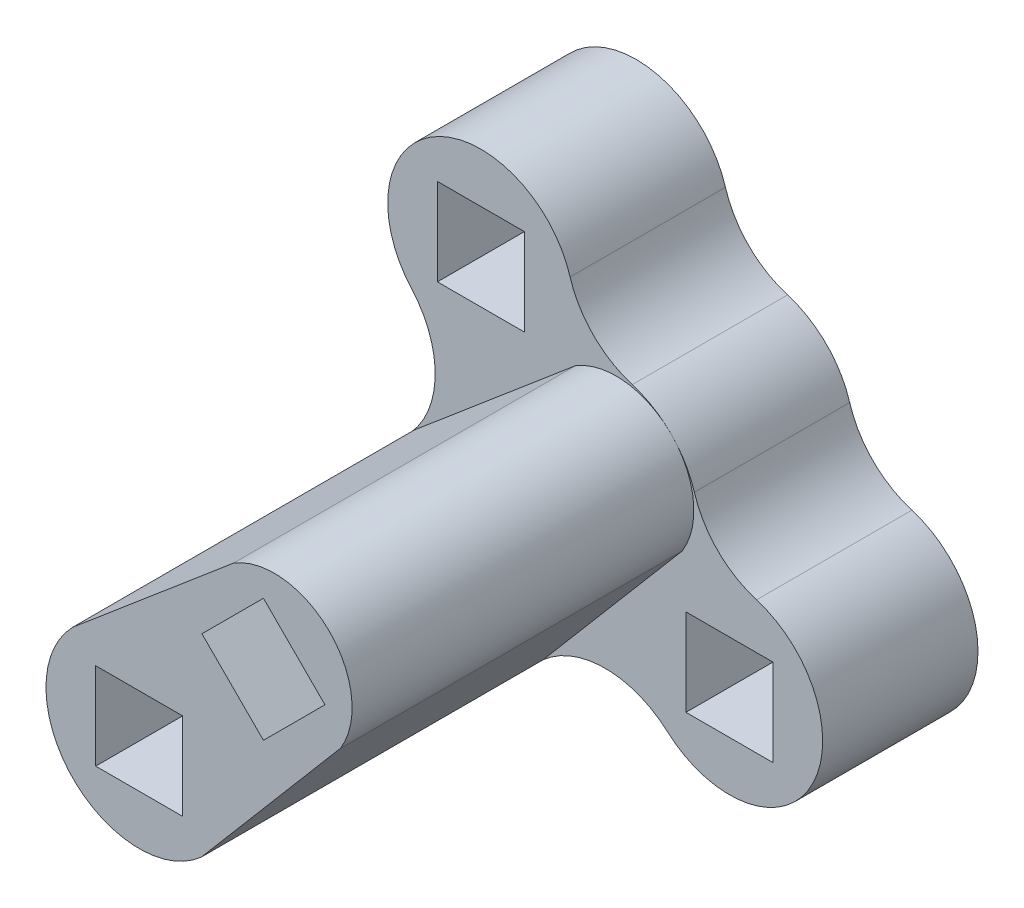
from build123d import *

# Parameters (mm, degrees)
ESBO_O1_W                  = 2.8
ESBO_O1_H                  = 2.8
RESSALTO_EXTRUS_O1_DEPTH   = 16
CORTE_EXTRUS_O_FINA1_START = -11
CORTE_EXTRUS_O_FINA1_DEPTH = 11


with BuildPart() as part:
    # Esboço1 → Ressalto-extrusão1 (new body)
    with BuildSketch(Plane.XY):
        with BuildLine():
            ThreePointArc((2.870828693, 8.870828693), (-1.470083208, 10.615120525), (-2.236067977, 6))
            ThreePointArc((-2.236067977, 6), (-1.472135955, 4), (-2.236067977, 2))
            ThreePointArc((-2.236067977, 2), (-2.121320344, -2.121320344), (2, -2.236067977))
            ThreePointArc((2, -2.236067977), (4, -1.472135955), (6, -2.236067977))
            ThreePointArc((6, -2.236067977), (10.615120525, -1.470083208), (8.870828693, 2.870828693))
            ThreePointArc((8.870828693, 2.870828693), (7.620337043, 3.620337043), (6.870828693, 4.870828693))
            ThreePointArc((6.870828693, 4.870828693), (6.121320344, 6.121320344), (4.870828693, 6.870828693))
            ThreePointArc((4.870828693, 6.870828693), (3.620337043, 7.620337043), (2.870828693, 8.870828693))
        make_face()
        with Locations((0, 8)):
            Rectangle(ESBO_O1_W, ESBO_O1_H, mode=Mode.SUBTRACT)
        Polygon((4, 5.979898987), (5.979898987, 4), (4, 2.020101013), (2.020101013, 4), align=None, mode=Mode.SUBTRACT)
        with Locations((8, 0)):
            Rectangle(ESBO_O1_W, ESBO_O1_H, mode=Mode.SUBTRACT)
        Rectangle(ESBO_O1_W, ESBO_O1_H, mode=Mode.SUBTRACT)
    extrude(amount=RESSALTO_EXTRUS_O1_DEPTH)

    # Esboço2 → Corte-Extrusão-Fina1 (cut)
    with BuildSketch(Plane.XY.offset(16).offset(CORTE_EXTRUS_O_FINA1_START)):
        with BuildLine():
            Line((9.333446825, -9.049130918), (14.39222363, -3.094607445))
            ThreePointArc((14.39222363, -3.094607445), (13.208027354, 13.176721236), (-3.059004987, 14.418541135))
            Line((-3.059004987, 14.418541135), (-8.835216439, 9.536191613))
            ThreePointArc((-8.835216439, 9.536191613), (-9.295999773, -9.087595294), (9.333446825, -9.049130918))
        make_face()
        with BuildLine():
            Line((2, -2.236067977), (6.47600505, 3.032493606))
            ThreePointArc((6.47600505, 3.032493606), (6.125574464, 6.117055961), (3.04273657, 6.482346303))
            Line((3.04273657, 6.482346303), (-2.144816713, 2.09756079))
            ThreePointArc((-2.144816713, 2.09756079), (-2.16802388, -2.073565156), (2, -2.236067977))
        make_face(mode=Mode.SUBTRACT)
    extrude(amount=CORTE_EXTRUS_O_FINA1_DEPTH, mode=Mode.SUBTRACT)


solid = part.part
